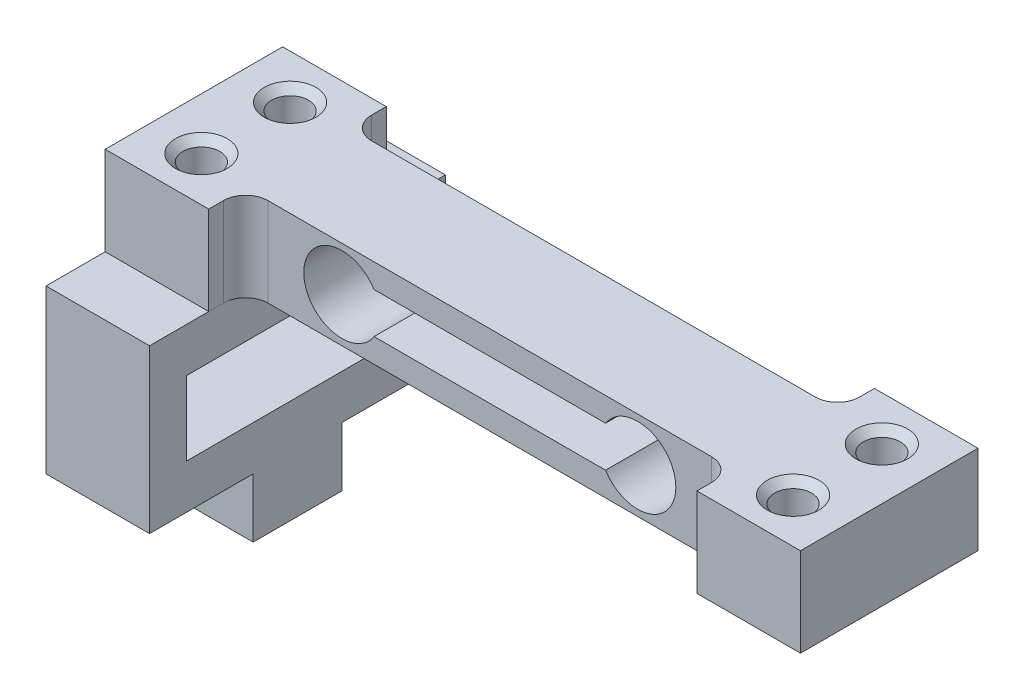
from build123d import *

# Parameters (mm, degrees)
BOSS_EXTRUDE1_DEPTH        = 3
CUT_EXTRUDE1_DEPTH         = 26.524498036
M3_TAPPED_HOLE1_AT_2_COUNT = 2
M3_TAPPED_HOLE1_AT_2_PITCH = 6
SKETCH8_W                  = 7
SKETCH8_H                  = 20
SKETCH8_R                  = 1.75
BOSS_EXTRUDE3_DEPTH        = 3
SKETCH9_W                  = 7
SKETCH9_H                  = 2.5
BOSS_EXTRUDE4_DEPTH        = 5
SKETCH10_W                 = 7
SKETCH10_H                 = 20
BOSS_EXTRUDE5_DEPTH        = 3
SKETCH11_W                 = 7
SKETCH11_H                 = 6
SKETCH11_W_2               = 2.5
SKETCH11_H_2               = 2.5
BOSS_EXTRUDE6_DEPTH        = 4


with BuildPart() as part:
    # Sketch1 → Boss-Extrude1 (new, symmetric)
    with BuildSketch(Plane(origin=(0, 0, 0), x_dir=(1, 0, 0), z_dir=(0, 1, 0))):
        with BuildLine():
            Line((0, -3.5), (0, 3.5))
            Line((0, 3.5), (15, 3.5))
            ThreePointArc((15, 3.5), (16.060660172, 3.939339828), (16.5, 5))
            Line((16.5, 5), (16.5, 6))
            Line((16.5, 6), (23.5, 6))
            Line((23.5, 6), (23.5, -6))
            Line((23.5, -6), (16.5, -6))
            Line((16.5, -6), (16.5, -5))
            ThreePointArc((16.5, -5), (16.060660172, -3.939339828), (15, -3.5))
            Line((15, -3.5), (0, -3.5))
        make_face()
    extrude(amount=BOSS_EXTRUDE1_DEPTH, both=True)

    # Sketch2 → Cut-Extrude1 (cut, through all)
    with BuildSketch(Plane.XY.offset(3.5)):
        with BuildLine():
            ThreePointArc((7.822845894, 1.375), (7.425, 0), (7.822845894, -1.375))
            Line((7.822845894, -1.375), (10, -1.375))
            Line((10, -1.375), (10, 1.375))
            Line((10, 1.375), (7.822845894, 1.375))
        make_face()
        with BuildLine():
            Line((10, -1.375), (7.822845894, -1.375))
            ThreePointArc((7.822845894, -1.375), (10.715700069, -2.473539652), (12.575, 0))
            ThreePointArc((12.575, 0), (10.715700069, 2.473539652), (7.822845894, 1.375))
            Line((7.822845894, 1.375), (10, 1.375))
            Line((10, 1.375), (10, -1.375))
        make_face()
        with BuildLine():
            Line((0, 1.375), (0, -1.375))
            Line((0, -1.375), (7.822845894, -1.375))
            ThreePointArc((7.822845894, -1.375), (7.425, 0), (7.822845894, 1.375))
            Line((7.822845894, 1.375), (0, 1.375))
        make_face()
    extrude(amount=-CUT_EXTRUDE1_DEPTH, mode=Mode.SUBTRACT)

    # Sketch5 → M3 Tapped Hole1 (revolve, cut)
    with BuildSketch(Plane(origin=(20, 3, -3), x_dir=(0, 0, 1), z_dir=(1, 0, 0))):
        Polygon((0, 0), (0, 6), (1.75, 6), (1.25, 5.5), (1.25, 0.5), (1.75, 0), align=None)
    m3_tapped_hole1 = revolve(axis=Axis((20, 9.35, -3), (0, -1, 0)), mode=Mode.SUBTRACT)

    # M3 Tapped Hole1 at 2: M3 Tapped Hole1 ×2
    with Locations(*[(0, 0, i * M3_TAPPED_HOLE1_AT_2_PITCH) for i in range(1, M3_TAPPED_HOLE1_AT_2_COUNT)]):
        add(m3_tapped_hole1, mode=Mode.SUBTRACT)

    # Mirror1: part across plane


with BuildPart() as part_1:
    add(part.part)
    add(part.part.mirror(Plane(origin=(0, 0, 0), x_dir=(0, 0, 1), z_dir=(1, 0, 0))))


with BuildPart() as body_2:
    # Sketch8 → Boss-Extrude3 (new body)
    with BuildSketch(Plane.XZ.offset(3)):
        with Locations((-20, 0)):
            Rectangle(SKETCH8_W, SKETCH8_H)
        with Locations(Location((-20, -3, 0), (0, 0, 270))):
            Circle(SKETCH8_R, mode=Mode.SUBTRACT)
        with Locations(Location((-20, 3, 0), (0, 0, 270))):
            Circle(SKETCH8_R, mode=Mode.SUBTRACT)
    extrude(amount=BOSS_EXTRUDE3_DEPTH)

    # Sketch9 → Boss-Extrude4 (add)
    with BuildSketch(Plane.XZ.offset(6)):
        with Locations((-20, 8.75)):
            Rectangle(SKETCH9_W, SKETCH9_H)
        with Locations((-20, -8.75)):
            Rectangle(SKETCH9_W, SKETCH9_H)
    extrude(amount=BOSS_EXTRUDE4_DEPTH)

    # Sketch10 → Boss-Extrude5 (add)
    with BuildSketch(Plane.XZ.offset(11)):
        with Locations((-20, 0)):
            Rectangle(SKETCH10_W, SKETCH10_H)
    extrude(amount=BOSS_EXTRUDE5_DEPTH)

    # Sketch11 → Boss-Extrude6 (add)
    with BuildSketch(Plane.XZ.offset(14)):
        with Locations((-20, 0)):
            Rectangle(SKETCH11_W, SKETCH11_H)
        with Locations((-20, 0)):
            Rectangle(SKETCH11_W_2, SKETCH11_H_2, mode=Mode.SUBTRACT)
    extrude(amount=BOSS_EXTRUDE6_DEPTH)


solid = Compound([part_1.part, body_2.part])
